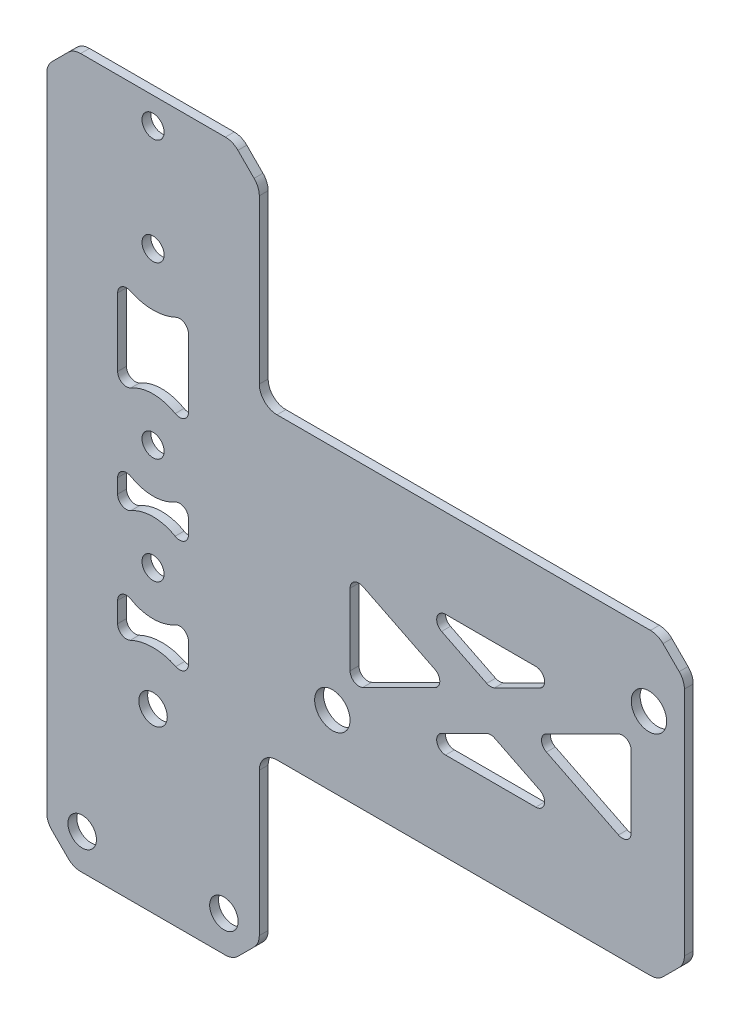
from build123d import *

# Parameters (mm, degrees)
SKETCH1_W           = 76.2
SKETCH1_H           = 53.594
SKETCH1_R           = 3.175
SKETCH1_W_2         = 38.1
SKETCH1_H_2         = 127
BOSS_EXTRUDE1_DEPTH = 0.79375
SKETCH2_R           = 2.5527
SKETCH2_R_2         = 1.9812
CUT_EXTRUDE1_DEPTH  = 115.487259799
CUT_EXTRUDE2_DEPTH  = 115.487259799
FILLET2_R           = 1.5875
CHAMFER1_SIZE       = 4.7625
FILLET3_R           = 3.175
CUT_EXTRUDE3_DEPTH  = 115.487259799
FILLET5_R           = 1.5875


with BuildPart() as part:
    # Sketch1 → Boss-Extrude1 (new, symmetric)
    # profile 1 of 2: a face of its own
    with BuildSketch(Plane.XY):
        with Locations((57.15, -1.778)):
            Rectangle(SKETCH1_W, SKETCH1_H)
        with Locations((32.1437, -15.875)):
            Circle(SKETCH1_R, mode=Mode.SUBTRACT)
        with Locations((88.9, 12.319)):
            Circle(SKETCH1_R, mode=Mode.SUBTRACT)
    # profile 2 of 2: a face of its own
    with BuildSketch(Plane.XY):
        Rectangle(SKETCH1_W_2, SKETCH1_H_2)
    extrude(amount=BOSS_EXTRUDE1_DEPTH, both=True)

    # Sketch2 → Cut-Extrude1 (cut, through all)
    with BuildSketch(Plane.XY.offset(0.79375)):
        with Locations((-12.7, -57.15)):
            Circle(SKETCH2_R)
        with Locations((12.7, -57.15)):
            Circle(SKETCH2_R)
        with Locations((0, -31.75)):
            Circle(SKETCH2_R)
        with Locations((0, -9.8425)):
            Circle(SKETCH2_R_2)
        with Locations((0, 9.2075)):
            Circle(SKETCH2_R_2)
        with Locations((0, 39.6875)):
            Circle(SKETCH2_R_2)
        with Locations((0, 58.7375)):
            Circle(SKETCH2_R_2)
    extrude(amount=-CUT_EXTRUDE1_DEPTH, mode=Mode.SUBTRACT)

    # Sketch3 → Cut-Extrude2 (cut, through all)
    with BuildSketch(Plane.XY.offset(0.79375)):
        Polygon((45.671811727, 9.144), (60.52185, 1.767162907), (75.371888273, 9.144), align=None)
        Polygon((35.3187, 7.196638614), (35.3187, -10.752638614), (53.385213498, -1.778), align=None)
        Polygon((60.52185, -5.323162907), (45.671811727, -12.7), (75.371888273, -12.7), align=None)
        Polygon((85.725, 7.196638614), (67.658486502, -1.778), (85.725, -10.752638614), align=None)
    extrude(amount=-CUT_EXTRUDE2_DEPTH, mode=Mode.SUBTRACT)

    # Fillet2
    fillet2_edges = [part.edges().sort_by_distance(p)[0] for p in [
        (60.52185, 1.767162907, 0),
        (45.671811727, 9.144, 0),
        (75.371888273, 9.144, 0),
        (35.3187, -10.752638614, 0),
        (35.3187, 7.196638614, 0),
        (53.385213498, -1.778, 0),
        (45.671811727, -12.7, 0),
        (60.52185, -5.323162907, 0),
        (75.371888273, -12.7, 0),
        (67.658486502, -1.778, 0),
        (85.725, 7.196638614, 0),
        (85.725, -10.752638614, 0),
    ]]
    fillet(fillet2_edges, radius=FILLET2_R)

    # Chamfer1
    chamfer1_edges = [part.edges().sort_by_distance(p)[0] for p in [
        (95.25, -28.575, 0),
        (19.05, -63.5, 0),
        (-19.05, -63.5, 0),
        (-19.05, 63.5, 0),
        (19.05, 63.5, 0),
        (95.25, 25.019, 0),
    ]]
    chamfer(chamfer1_edges, length=CHAMFER1_SIZE)

    # Fillet3
    fillet3_edges = [part.edges().sort_by_distance(p)[0] for p in [
        (19.05, -28.575, 0),
        (90.4875, 25.019, 0),
        (19.05, 25.019, 0),
        (95.25, -23.8125, 0),
        (95.25, 20.2565, 0),
        (90.4875, -28.575, 0),
        (19.05, -58.7375, 0),
        (-14.2875, -63.5, 0),
        (14.2875, -63.5, 0),
        (-19.05, 58.7375, 0),
        (-19.05, -58.7375, 0),
        (-14.2875, 63.5, 0),
        (14.2875, 63.5, 0),
        (19.05, 58.7375, 0),
    ]]
    fillet(fillet3_edges, radius=FILLET3_R)

    # Sketch5 → Cut-Extrude3 (cut, through all)
    with BuildSketch(Plane.XY.offset(0.79375)):
        with BuildLine():
            ThreePointArc((-6.35, -24.650484171), (0, -22.225), (6.35, -24.650484171))
            Line((6.35, -24.650484171), (6.35, -14.605))
            ThreePointArc((6.35, -14.605), (0, -17.78), (-6.35, -14.605))
            Line((-6.35, -14.605), (-6.35, -24.650484171))
        make_face()
        with BuildLine():
            Line((6.35, -5.08), (6.35, 4.445))
            ThreePointArc((6.35, 4.445), (0, 1.27), (-6.35, 4.445))
            Line((-6.35, 4.445), (-6.35, -5.08))
            ThreePointArc((-6.35, -5.08), (0, -1.905), (6.35, -5.08))
        make_face()
        with BuildLine():
            Line((6.35, 13.97), (6.35, 28.194))
            Line((6.35, 28.194), (6.35, 32.587984171))
            ThreePointArc((6.35, 32.587984171), (0, 30.1625), (-6.35, 32.587984171))
            Line((-6.35, 32.587984171), (-6.35, 13.97))
            ThreePointArc((-6.35, 13.97), (0, 17.145), (6.35, 13.97))
        make_face()
    extrude(amount=-CUT_EXTRUDE3_DEPTH, mode=Mode.SUBTRACT)

    # Fillet5
    fillet5_edges = [part.edges().sort_by_distance(p)[0] for p in [
        (6.35, -24.650484171, 0),
        (-6.35, -24.650484171, 0),
        (-6.35, -14.605, 0),
        (6.35, -14.605, 0),
        (6.35, -5.08, 0),
        (-6.35, -5.08, 0),
        (-6.35, 4.445, 0),
        (6.35, 4.445, 0),
        (6.35, 13.97, 0),
        (-6.35, 13.97, 0),
        (-6.35, 32.587984171, 0),
        (6.35, 32.587984171, 0),
    ]]
    fillet(fillet5_edges, radius=FILLET5_R)


solid = part.part
